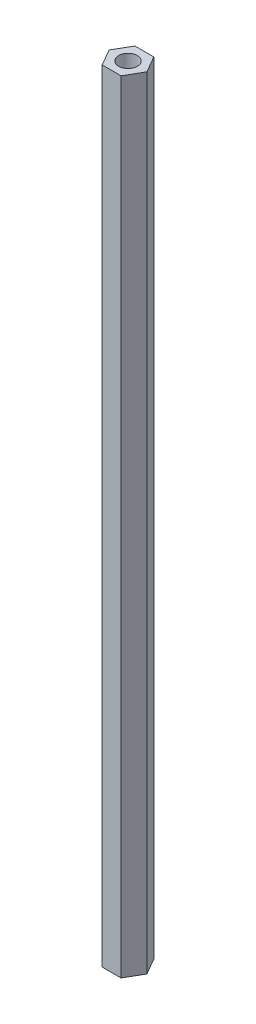
from build123d import *

# Parameters (mm, degrees)
SKETCH1_R           = 2
BOSS_EXTRUDE1_DEPTH = 167


with BuildPart() as part:
    # Sketch1 → Boss-Extrude1 (new body)
    with BuildSketch(Plane(origin=(0, 0, 0), x_dir=(1, 0, 0), z_dir=(0, 1, 0))):
        Polygon((4.041451884, 0), (2.020725942, 3.5), (-2.020725942, 3.5), (-4.041451884, 0), (-2.020725942, -3.5), (2.020725942, -3.5), align=None)
        with Locations(Location((0, 0, 0), (0, 0, 90))):
            Circle(SKETCH1_R, mode=Mode.SUBTRACT)
    extrude(amount=BOSS_EXTRUDE1_DEPTH)


solid = part.part
